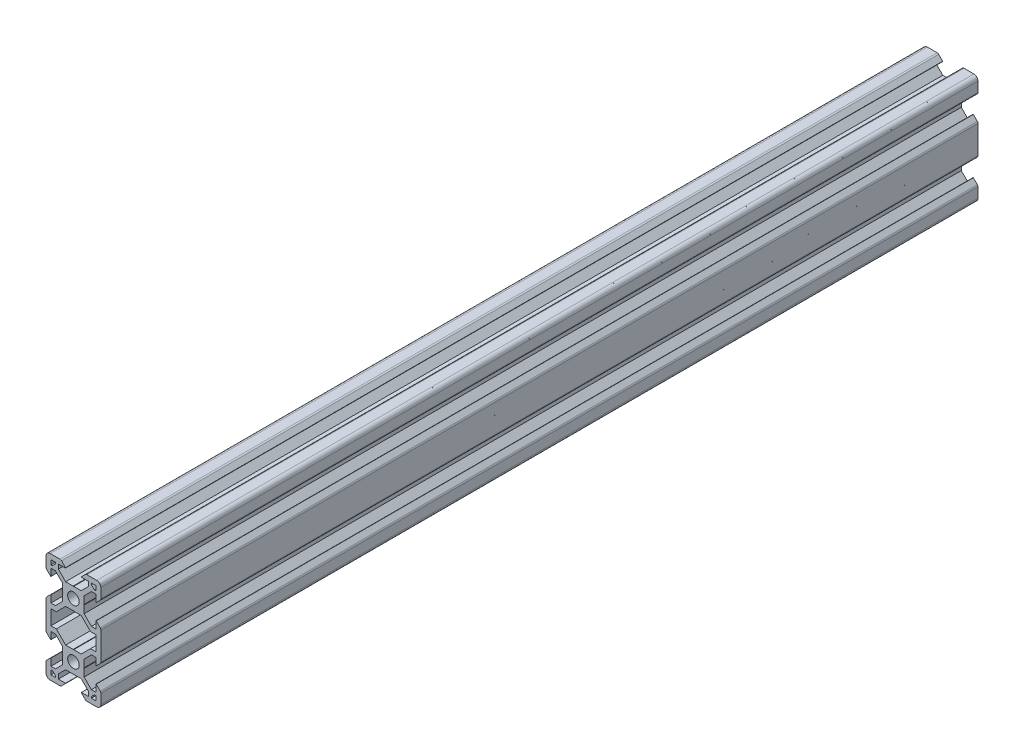
from build123d import *

# Parameters (mm, degrees)
SKETCH2_R           = 2.1
BOSS_EXTRUDE1_DEPTH = 320


with BuildPart() as part:
    # Sketch2 → Boss-Extrude1 (new body)
    with BuildSketch(Plane.XY):
        with BuildLine():
            Line((-0.1, 3.9), (0, 3.8))
            Line((0, 3.8), (0.1, 3.9))
            Line((0.1, 3.9), (2.840365134, 3.9))
            Line((2.840365134, 3.9), (5.5, 6.558825842))
            Line((5.5, 6.558825842), (5.5, 8.197505675))
            Line((5.5, 8.197505675), (2.89, 8.197505675))
            Line((2.89, 8.197505675), (2.89, 8.307505675))
            Line((2.89, 8.307505675), (4.348614357, 9.766120032))
            ThreePointArc((4.348614357, 9.766120032), (4.604908803, 9.937370505), (4.907228714, 9.997505675))
            Line((4.907228714, 9.997505675), (8.5, 9.997505675))
            ThreePointArc((8.5, 9.997505675), (9.560660172, 9.558165846), (10, 8.497505675))
            Line((10, 8.497505675), (10, 4.904734389))
            ThreePointArc((10, 4.904734389), (9.939864831, 4.602414477), (9.768614357, 4.346120032))
            Line((9.768614357, 4.346120032), (8.31, 2.887505675))
            Line((8.31, 2.887505675), (8.2, 2.887505675))
            Line((8.2, 2.887505675), (8.2, 5.497505675))
            Line((8.2, 5.497505675), (6.56, 5.497505675))
            Line((6.56, 5.497505675), (3.9, 2.83831481))
            Line((3.9, 2.83831481), (3.9, 0.1))
            Line((3.9, 0.1), (3.8, 0))
            Line((3.8, 0), (3.9, -0.1))
            Line((3.9, -0.1), (3.9, -2.84))
            Line((3.9, -2.84), (6.56, -5.5))
            Line((6.56, -5.5), (8.2, -5.5))
            Line((8.2, -5.5), (8.2, -2.89))
            Line((8.2, -2.89), (8.31, -2.89))
            Line((8.31, -2.89), (9.765685425, -4.345685425))
            ThreePointArc((9.765685425, -4.345685425), (9.939103626, -4.605224104), (10, -4.91137085))
            Line((10, -4.91137085), (10, -15.08862915))
            ThreePointArc((10, -15.08862915), (9.939103626, -15.394775896), (9.765685425, -15.654314575))
            Line((9.765685425, -15.654314575), (8.31, -17.11))
            Line((8.31, -17.11), (8.2, -17.11))
            Line((8.2, -17.11), (8.2, -14.5))
            Line((8.2, -14.5), (6.56, -14.5))
            Line((6.56, -14.5), (3.9, -17.16))
            Line((3.9, -17.16), (3.9, -19.9))
            Line((3.9, -19.9), (3.8, -20))
            Line((3.8, -20), (3.9, -20.1))
            Line((3.9, -20.1), (3.9, -22.83831481))
            Line((3.9, -22.83831481), (6.56, -25.497505675))
            Line((6.56, -25.497505675), (8.2, -25.497505675))
            Line((8.2, -25.497505675), (8.2, -22.887505675))
            Line((8.2, -22.887505675), (8.31, -22.887505675))
            Line((8.31, -22.887505675), (9.768614357, -24.346120032))
            ThreePointArc((9.768614357, -24.346120032), (9.939864831, -24.602414477), (10, -24.904734389))
            Line((10, -24.904734389), (10, -28.497505675))
            ThreePointArc((10, -28.497505675), (9.560660172, -29.558165846), (8.5, -29.997505675))
            Line((8.5, -29.997505675), (4.907228714, -29.997505675))
            ThreePointArc((4.907228714, -29.997505675), (4.604908803, -29.937370505), (4.348614357, -29.766120032))
            Line((4.348614357, -29.766120032), (2.89, -28.307505675))
            Line((2.89, -28.307505675), (2.89, -28.197505675))
            Line((2.89, -28.197505675), (5.5, -28.197505675))
            Line((5.5, -28.197505675), (5.5, -26.558825842))
            Line((5.5, -26.558825842), (2.840365134, -23.9))
            Line((2.840365134, -23.9), (0.1, -23.9))
            Line((0.1, -23.9), (0, -23.8))
            Line((0, -23.8), (-0.1, -23.9))
            Line((-0.1, -23.9), (-2.840365134, -23.9))
            Line((-2.840365134, -23.9), (-5.5, -26.558825842))
            Line((-5.5, -26.558825842), (-5.5, -28.197505675))
            Line((-5.5, -28.197505675), (-2.89, -28.197505675))
            Line((-2.89, -28.197505675), (-2.89, -28.307505675))
            Line((-2.89, -28.307505675), (-4.348614357, -29.766120032))
            ThreePointArc((-4.348614357, -29.766120032), (-4.604908803, -29.937370505), (-4.907228714, -29.997505675))
            Line((-4.907228714, -29.997505675), (-8.5, -29.997505675))
            ThreePointArc((-8.5, -29.997505675), (-9.560660172, -29.558165846), (-10, -28.497505675))
            Line((-10, -28.497505675), (-10, -24.904734389))
            ThreePointArc((-10, -24.904734389), (-9.939864831, -24.602414477), (-9.768614357, -24.346120032))
            Line((-9.768614357, -24.346120032), (-8.31, -22.887505675))
            Line((-8.31, -22.887505675), (-8.2, -22.887505675))
            Line((-8.2, -22.887505675), (-8.2, -25.497505675))
            Line((-8.2, -25.497505675), (-6.56, -25.497505675))
            Line((-6.56, -25.497505675), (-3.9, -22.83831481))
            Line((-3.9, -22.83831481), (-3.9, -20.1))
            Line((-3.9, -20.1), (-3.8, -20))
            Line((-3.8, -20), (-3.9, -19.9))
            Line((-3.9, -19.9), (-3.9, -17.16))
            Line((-3.9, -17.16), (-6.56, -14.5))
            Line((-6.56, -14.5), (-8.2, -14.5))
            Line((-8.2, -14.5), (-8.2, -17.11))
            Line((-8.2, -17.11), (-8.31, -17.11))
            Line((-8.31, -17.11), (-9.765685425, -15.654314575))
            ThreePointArc((-9.765685425, -15.654314575), (-9.939103626, -15.394775896), (-10, -15.08862915))
            Line((-10, -15.08862915), (-10, -4.91137085))
            ThreePointArc((-10, -4.91137085), (-9.939103626, -4.605224104), (-9.765685425, -4.345685425))
            Line((-9.765685425, -4.345685425), (-8.31, -2.89))
            Line((-8.31, -2.89), (-8.2, -2.89))
            Line((-8.2, -2.89), (-8.2, -5.5))
            Line((-8.2, -5.5), (-6.56, -5.5))
            Line((-6.56, -5.5), (-3.9, -2.84))
            Line((-3.9, -2.84), (-3.9, -0.1))
            Line((-3.9, -0.1), (-3.8, 0))
            Line((-3.8, 0), (-3.9, 0.1))
            Line((-3.9, 0.1), (-3.9, 2.83831481))
            Line((-3.9, 2.83831481), (-6.56, 5.497505675))
            Line((-6.56, 5.497505675), (-8.2, 5.497505675))
            Line((-8.2, 5.497505675), (-8.2, 2.887505675))
            Line((-8.2, 2.887505675), (-8.31, 2.887505675))
            Line((-8.31, 2.887505675), (-9.768614357, 4.346120032))
            ThreePointArc((-9.768614357, 4.346120032), (-9.939864831, 4.602414477), (-10, 4.904734389))
            Line((-10, 4.904734389), (-10, 8.497505675))
            ThreePointArc((-10, 8.497505675), (-9.560660172, 9.558165846), (-8.5, 9.997505675))
            Line((-8.5, 9.997505675), (-4.907228714, 9.997505675))
            ThreePointArc((-4.907228714, 9.997505675), (-4.604908803, 9.937370505), (-4.348614357, 9.766120032))
            Line((-4.348614357, 9.766120032), (-2.89, 8.307505675))
            Line((-2.89, 8.307505675), (-2.89, 8.197505675))
            Line((-2.89, 8.197505675), (-5.5, 8.197505675))
            Line((-5.5, 8.197505675), (-5.5, 6.558825842))
            Line((-5.5, 6.558825842), (-2.840365134, 3.9))
            Line((-2.840365134, 3.9), (-0.1, 3.9))
        make_face()
        Circle(SKETCH2_R, mode=Mode.SUBTRACT)
        with Locations(Location((0, -20, 0), (0, 0, 180))):
            Circle(SKETCH2_R, mode=Mode.SUBTRACT)
        Polygon((-7.66, 6.567505675), (-6.57, 7.657505675), (-6.57, 8.197505675), (-8.2, 8.197505675), (-8.2, 6.567505675), align=None, mode=Mode.SUBTRACT)
        Polygon((-0.1, -3.9), (0, -3.8), (0.1, -3.9), (2.840365134, -3.9), (6.24, -7.299634866), (8.2, -7.299634866), (8.2, -12.700365134), (6.24, -12.700365134), (2.840365134, -16.1), (0.1, -16.1), (0, -16.2), (-0.1, -16.1), (-2.840365134, -16.1), (-6.24, -12.700365134), (-8.2, -12.700365134), (-8.2, -7.299634866), (-6.24, -7.299634866), (-2.840365134, -3.9), align=None, mode=Mode.SUBTRACT)
        Polygon((8.2, 6.567505675), (7.66, 6.567505675), (6.57, 7.657505675), (6.57, 8.197505675), (8.2, 8.197505675), align=None, mode=Mode.SUBTRACT)
        Polygon((7.66, -26.567505675), (6.57, -27.657505675), (6.57, -28.197505675), (8.2, -28.197505675), (8.2, -26.567505675), align=None, mode=Mode.SUBTRACT)
        Polygon((-8.2, -26.567505675), (-7.66, -26.567505675), (-6.57, -27.657505675), (-6.57, -28.197505675), (-8.2, -28.197505675), align=None, mode=Mode.SUBTRACT)
    extrude(amount=-BOSS_EXTRUDE1_DEPTH)


solid = part.part
